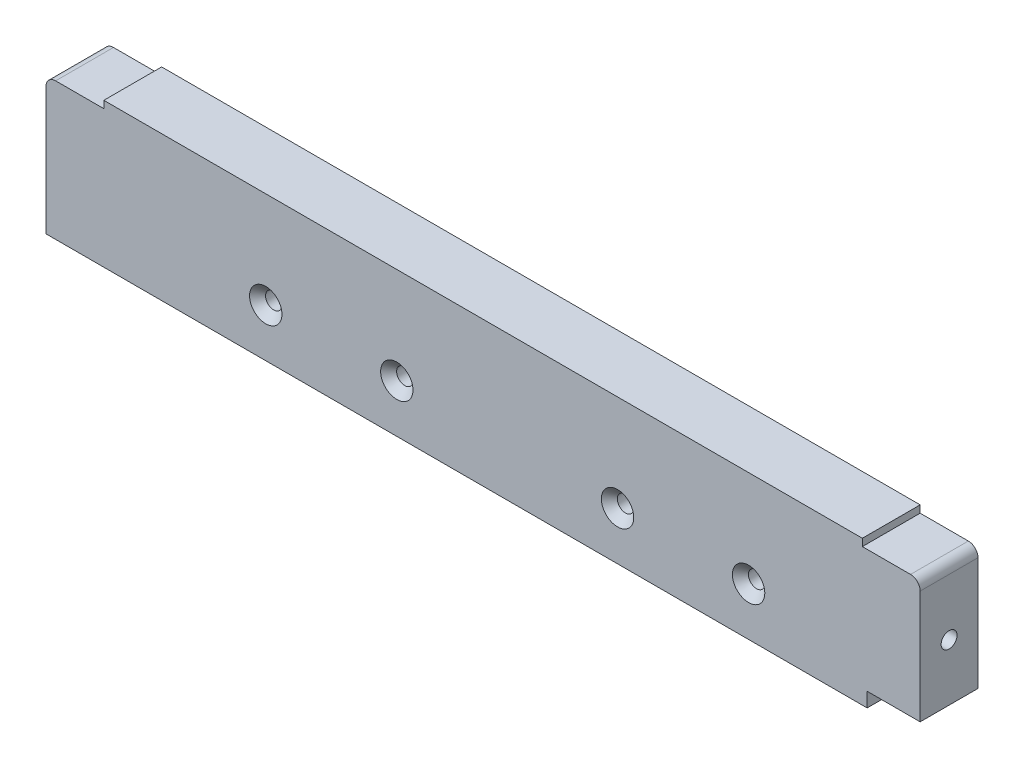
from build123d import *

# Parameters (mm, degrees)
ESBO_O1_W                                      = 119
ESBO_O1_H                                      = 30
RESSALTO_EXTRUS_O1_DEPTH                       = 12
ESCAREADO_PARA_SFHCS_M31_D                     = 3.4
ESCAREADO_PARA_SFHCS_M31_CSINK_D               = 6.72
ESCAREADO_PARA_SFHCS_M31_CSINK_ANGLE           = 90
ESBO_O6_W                                      = 36.2
ESBO_O6_H                                      = 30
RESSALTO_EXTRUS_O2_DEPTH                       = 12
ESBO_O7_W                                      = 26.2
ESBO_O7_H                                      = 30
RESSALTO_EXTRUS_O3_DEPTH                       = 12
ESBO_O8_W                                      = 12
ESBO_O8_H                                      = 12
CORTE_EXTRUS_O1_DEPTH                          = 1.5
FILETE1_R                                      = 2
ESBO_O9_W                                      = 11
ESBO_O9_H                                      = 12
CORTE_EXTRUS_O2_DEPTH                          = 3
BROCA_DE_ROSQUEAR_PARA_TARRAXA_DE_M4X0_7_D     = 3.3
BROCA_DE_ROSQUEAR_PARA_TARRAXA_DE_M4X0_7_DEPTH = 10
BROCA_DE_ROSQUEAR_PARA_TARRAXA_DE_M4X0_7_TIP   = 0.991420021
ESBO_O12_W                                     = 12
ESBO_O12_H                                     = 12
CORTE_EXTRUS_O3_DEPTH                          = 1.5
FILETE2_R                                      = 2
BROCA_DE_ROSQUEAR_PARA_TARRAXA_DE_M4_2_D       = 3.3
BROCA_DE_ROSQUEAR_PARA_TARRAXA_DE_M4_2_DEPTH   = 10
BROCA_DE_ROSQUEAR_PARA_TARRAXA_DE_M4_2_TIP     = 0.991420021


with BuildPart() as part:
    # Esboço1 → Ressalto-extrusão1 (new body)
    with BuildSketch(Plane.XY):
        with Locations((-14.240307174, 185)):
            Rectangle(ESBO_O1_W, ESBO_O1_H)
    extrude(amount=RESSALTO_EXTRUS_O1_DEPTH)

    # Escareado para SFHCS M31 (through all)
    with Locations(Plane.XY.offset(12)):
        with Locations((35.859692826, 180), (-64.340307174, 180), (-37.140307174, 180), (8.659692826, 180)):
            CounterSinkHole(ESCAREADO_PARA_SFHCS_M31_D / 2, ESCAREADO_PARA_SFHCS_M31_CSINK_D / 2, counter_sink_angle=ESCAREADO_PARA_SFHCS_M31_CSINK_ANGLE)

    # Esboço6 → Ressalto-extrusão2 (add)
    with BuildSketch(Plane.XY):
        with Locations((-91.840307174, 185)):
            Rectangle(ESBO_O6_W, ESBO_O6_H)
    extrude(amount=RESSALTO_EXTRUS_O2_DEPTH)

    # Esboço7 → Ressalto-extrusão3 (add)
    with BuildSketch(Plane.XY):
        with Locations((58.359692826, 185)):
            Rectangle(ESBO_O7_W, ESBO_O7_H)
    extrude(amount=RESSALTO_EXTRUS_O3_DEPTH)

    # Esboço8 → Corte-extrusão1 (cut)
    with BuildSketch(Plane(origin=(0, 200, 0), x_dir=(1, 0, 0), z_dir=(0, 1, 0))):
        with Locations((65.459692826, -6)):
            Rectangle(ESBO_O8_W, ESBO_O8_H)
    extrude(amount=-CORTE_EXTRUS_O1_DEPTH, mode=Mode.SUBTRACT)

    # Filete1
    filete1_edges = [part.edges().sort_by_distance(p)[0] for p in [
        (71.459692826, 198.5, 6),
    ]]
    fillet(filete1_edges, radius=FILETE1_R)

    # Esboço9 → Corte-extrusão2 (cut)
    with BuildSketch(Plane.XZ.offset(-170)):
        with Locations((65.959692826, 6)):
            Rectangle(ESBO_O9_W, ESBO_O9_H)
    extrude(amount=-CORTE_EXTRUS_O2_DEPTH, mode=Mode.SUBTRACT)

    # Broca de rosquear para tarraxa de M4x0.7
    with Locations(Plane(origin=(71.459692826, 0, 0), x_dir=(0, 0, -1), z_dir=(1, 0, 0))):
        with Locations((-6, 184.75)):
            Hole(BROCA_DE_ROSQUEAR_PARA_TARRAXA_DE_M4X0_7_D / 2, depth=BROCA_DE_ROSQUEAR_PARA_TARRAXA_DE_M4X0_7_DEPTH)
            with Locations((0, 0, -(BROCA_DE_ROSQUEAR_PARA_TARRAXA_DE_M4X0_7_DEPTH + BROCA_DE_ROSQUEAR_PARA_TARRAXA_DE_M4X0_7_TIP / 2))):  # 118° drill point
                Cone(0, BROCA_DE_ROSQUEAR_PARA_TARRAXA_DE_M4X0_7_D / 2, BROCA_DE_ROSQUEAR_PARA_TARRAXA_DE_M4X0_7_TIP, mode=Mode.SUBTRACT)

    # Esboço12 → Corte-extrusão3 (cut)
    with BuildSketch(Plane(origin=(0, 200, 0), x_dir=(-1, 0, 0), z_dir=(0, 1, 0))):
        with Locations((103.940307174, 6)):
            Rectangle(ESBO_O12_W, ESBO_O12_H)
    extrude(amount=-CORTE_EXTRUS_O3_DEPTH, mode=Mode.SUBTRACT)

    # Filete2
    filete2_edges = [part.edges().sort_by_distance(p)[0] for p in [
        (-109.940307174, 198.5, 6),
    ]]
    fillet(filete2_edges, radius=FILETE2_R)

    # Broca de rosquear para tarraxa de M4 2
    with Locations(Plane.ZY.offset(109.940307174)):
        with Locations((5.5, 184.558440573), (-130.6, 184.75)):
            Hole(BROCA_DE_ROSQUEAR_PARA_TARRAXA_DE_M4_2_D / 2, depth=BROCA_DE_ROSQUEAR_PARA_TARRAXA_DE_M4_2_DEPTH)
            with Locations((0, 0, -(BROCA_DE_ROSQUEAR_PARA_TARRAXA_DE_M4_2_DEPTH + BROCA_DE_ROSQUEAR_PARA_TARRAXA_DE_M4_2_TIP / 2))):  # 118° drill point
                Cone(0, BROCA_DE_ROSQUEAR_PARA_TARRAXA_DE_M4_2_D / 2, BROCA_DE_ROSQUEAR_PARA_TARRAXA_DE_M4_2_TIP, mode=Mode.SUBTRACT)


solid = part.part
